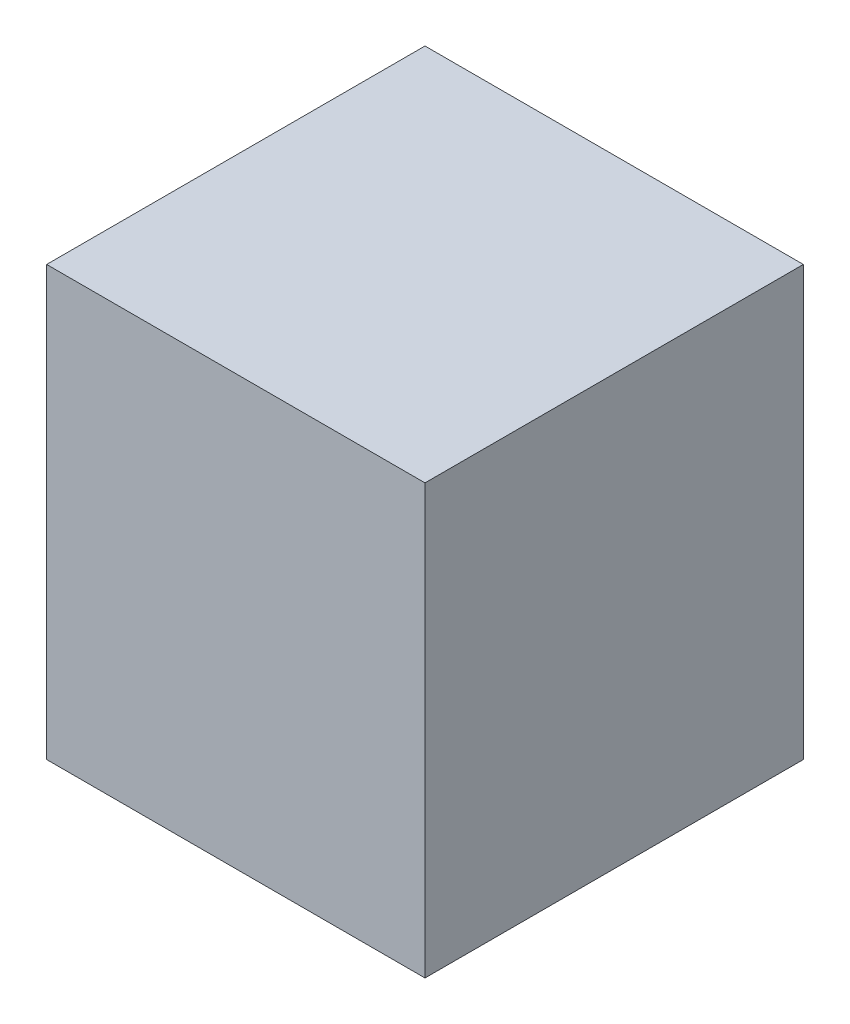
from build123d import *

# Parameters (mm, degrees)
SKETCH1_W           = 60
SKETCH1_H           = 60
BOSS_EXTRUDE1_DEPTH = 68


with BuildPart() as part:
    # Sketch1 → Boss-Extrude1 (new body)
    with BuildSketch(Plane(origin=(0, 0, 0), x_dir=(1, 0, 0), z_dir=(0, 1, 0))):
        with Locations((6.89806835, -15.858615575)):
            Rectangle(SKETCH1_W, SKETCH1_H)
    extrude(amount=BOSS_EXTRUDE1_DEPTH)


solid = part.part
